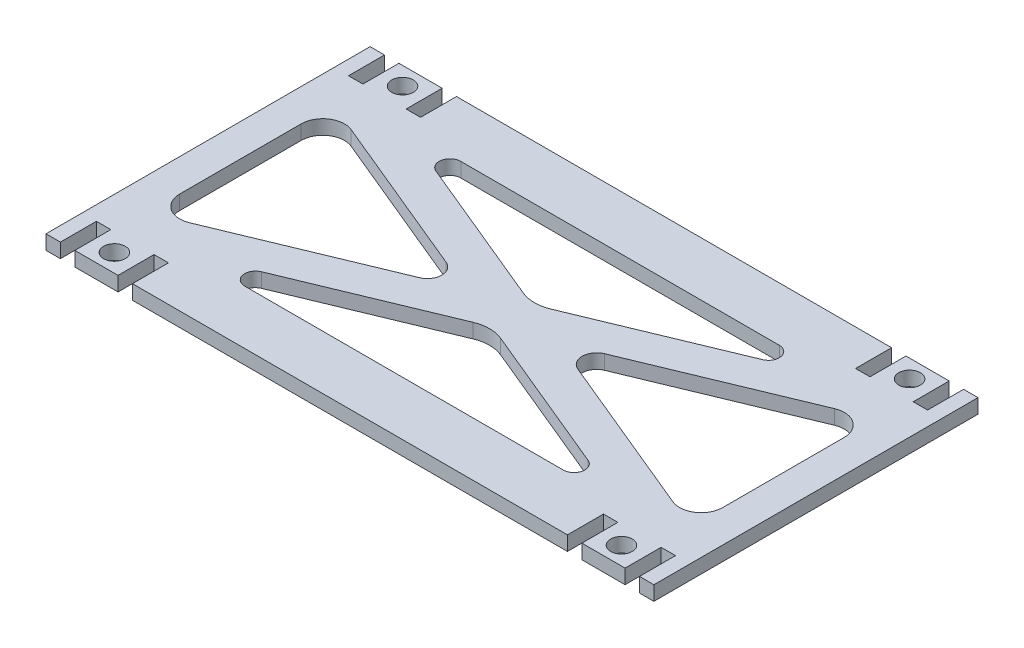
from build123d import *

# Parameters (mm, degrees)
SKETCH1_R           = 1.5
BOSS_EXTRUDE1_DEPTH = 2
CUT_EXTRUDE2_DEPTH  = 10
FILLET30_R          = 1.5
FILLET31_R          = 5
FILLET32_R          = 2
FILLET33_R          = 3


with BuildPart() as part:
    # Sketch1 → Boss-Extrude1 (new body)
    with BuildSketch(Plane(origin=(0, 0, 0), x_dir=(1, 0, 0), z_dir=(0, 1, 0))):
        Polygon((0, 0), (2, 0), (2, 5), (4, 5), (4, 0), (10, 0), (10, 5), (12, 5), (12, 0), (72.4, 0), (72.4, 5), (74.4, 5), (74.4, 0), (80.4, 0), (80.4, 5), (82.4, 5), (82.4, 0), (84.4, 0), (84.4, 45), (82.4, 45), (82.4, 40), (80.4, 40), (80.4, 45), (74.4, 45), (74.4, 40), (72.4, 40), (72.4, 45), (12, 45), (12, 40), (10, 40), (10, 45), (4, 45), (4, 40), (2, 40), (2, 45), (0, 45), align=None)
        with Locations(Location((7, 42.5, 0), (0, 0, 270))):
            Circle(SKETCH1_R, mode=Mode.SUBTRACT)
        with Locations(Location((77.4, 42.5, 0), (0, 0, 90))):
            Circle(SKETCH1_R, mode=Mode.SUBTRACT)
        with Locations(Location((7, 2.5, 0), (0, 0, 90))):
            Circle(SKETCH1_R, mode=Mode.SUBTRACT)
        with Locations(Location((77.4, 2.5, 0), (0, 0, 270))):
            Circle(SKETCH1_R, mode=Mode.SUBTRACT)
    extrude(amount=BOSS_EXTRUDE1_DEPTH)

    # Sketch3 → Cut-Extrude2 (cut)
    with BuildSketch(Plane(origin=(0, 2, 0), x_dir=(1, 0, 0), z_dir=(0, 1, 0))):
        Polygon((71.845045693, 7.5), (12.554954307, 7.5), (42.2, 19.793561603), align=None)
        Polygon((4.5, 35.427447859), (4.5, 9.572552141), (35.673617122, 22.5), align=None)
        Polygon((12.554954307, 37.5), (42.2, 25.206438397), (71.845045693, 37.5), align=None)
        Polygon((79.9, 35.427447859), (79.9, 9.572552141), (48.726382878, 22.5), align=None)
    extrude(amount=-CUT_EXTRUDE2_DEPTH, mode=Mode.SUBTRACT)

    # Fillet30
    fillet30_edges = [part.edges().sort_by_distance(p)[0] for p in [
        (12.554954307, 1, -7.5),
        (71.845045693, 1, -7.5),
        (71.845045693, 1, -37.5),
        (12.554954307, 1, -37.5),
    ]]
    fillet(fillet30_edges, radius=FILLET30_R)

    # Fillet31
    fillet31_edges = [part.edges().sort_by_distance(p)[0] for p in [
        (42.2, 1, -19.793561603),
        (42.2, 1, -25.206438397),
    ]]
    fillet(fillet31_edges, radius=FILLET31_R)

    # Fillet32
    fillet32_edges = [part.edges().sort_by_distance(p)[0] for p in [
        (35.673617122, 1, -22.5),
        (48.726382878, 1, -22.5),
    ]]
    fillet(fillet32_edges, radius=FILLET32_R)

    # Fillet33
    fillet33_edges = [part.edges().sort_by_distance(p)[0] for p in [
        (4.5, 1, -9.572552141),
        (4.5, 1, -35.427447859),
        (79.9, 1, -35.427447859),
        (79.9, 1, -9.572552141),
    ]]
    fillet(fillet33_edges, radius=FILLET33_R)


solid = part.part
